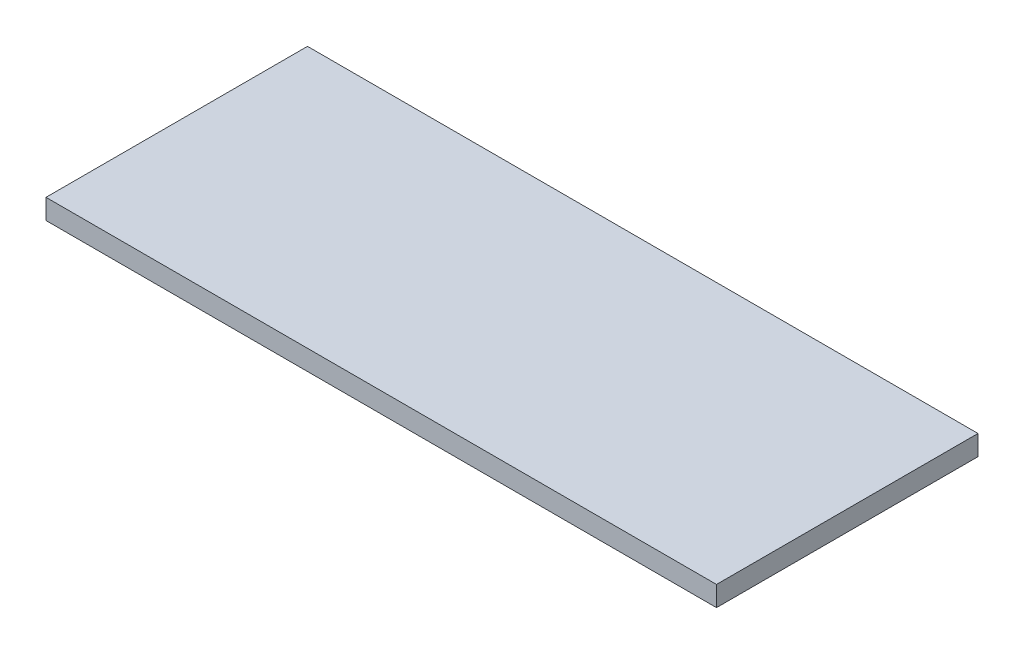
from build123d import *

# Parameters (mm, degrees)
SKETCH_1_W      = 100
SKETCH_1_H      = 39
EXTRUDE_1_DEPTH = 3


with BuildPart() as part:
    # 草图1 → 凸台-拉伸1 (new body)
    with BuildSketch(Plane(origin=(0, 0, 0), x_dir=(1, 0, 0), z_dir=(0, 1, 0))):
        with Locations((1.202730253, 5.221795601)):
            Rectangle(SKETCH_1_W, SKETCH_1_H)
    extrude(amount=EXTRUDE_1_DEPTH)


solid = part.part
